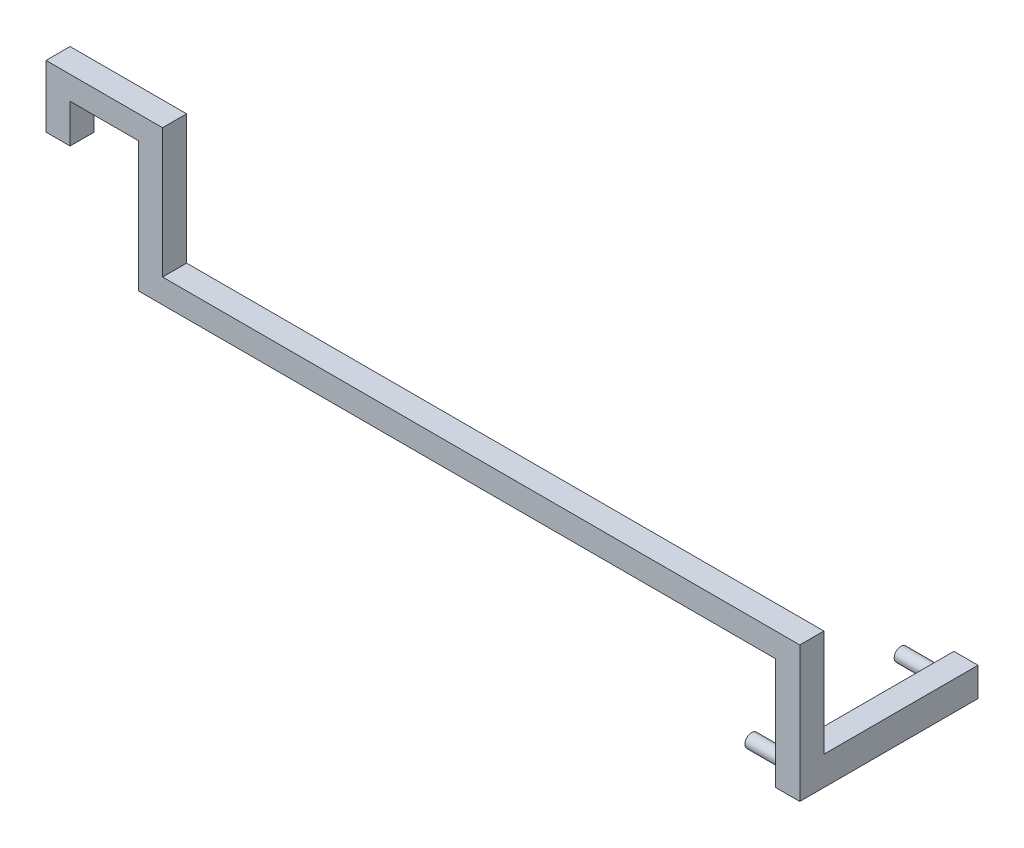
from build123d import *

# Parameters (mm, degrees)
BOSS_EXTRUDE1_DEPTH = 5
SKETCH5_W           = 5
SKETCH5_H           = 6
BOSS_EXTRUDE7_DEPTH = 32
SKETCH4_R           = 1.4
BOSS_EXTRUDE4_DEPTH = 8


with BuildPart() as part:
    # Sketch1 → Boss-Extrude1 (new body)
    with BuildSketch(Plane.XY):
        Polygon((0, 6.7), (0, 8.05), (5.5, 8.05), (14.2, 8.05), (14.2, -18.95), (146.5, -18.95), (146.5, -42.1), (151.5, -42.1), (151.5, -13.95), (19.2, -13.95), (19.2, 12.9), (5.5, 12.9), (-5, 12.9), (-5, 0), (0, 0), align=None)
    extrude(amount=BOSS_EXTRUDE1_DEPTH)

    # Sketch5 → Boss-Extrude7 (add)
    with BuildSketch(Plane(origin=(0, 0, 0), x_dir=(-1, 0, 0), z_dir=(0, 0, -1))):
        with Locations((-149, -39.1)):
            Rectangle(SKETCH5_W, SKETCH5_H)
    extrude(amount=BOSS_EXTRUDE7_DEPTH)

    # Sketch4 → Boss-Extrude4 (add)
    with BuildSketch(Plane.ZY.offset(-146.5)):
        with Locations(Location((-29, -39.1, 0), (0, 0, 180))):
            Circle(SKETCH4_R)
        with Locations(Location((2, -39.1, 0), (0, 0, 180))):
            Circle(SKETCH4_R)
    extrude(amount=BOSS_EXTRUDE4_DEPTH)


solid = part.part
